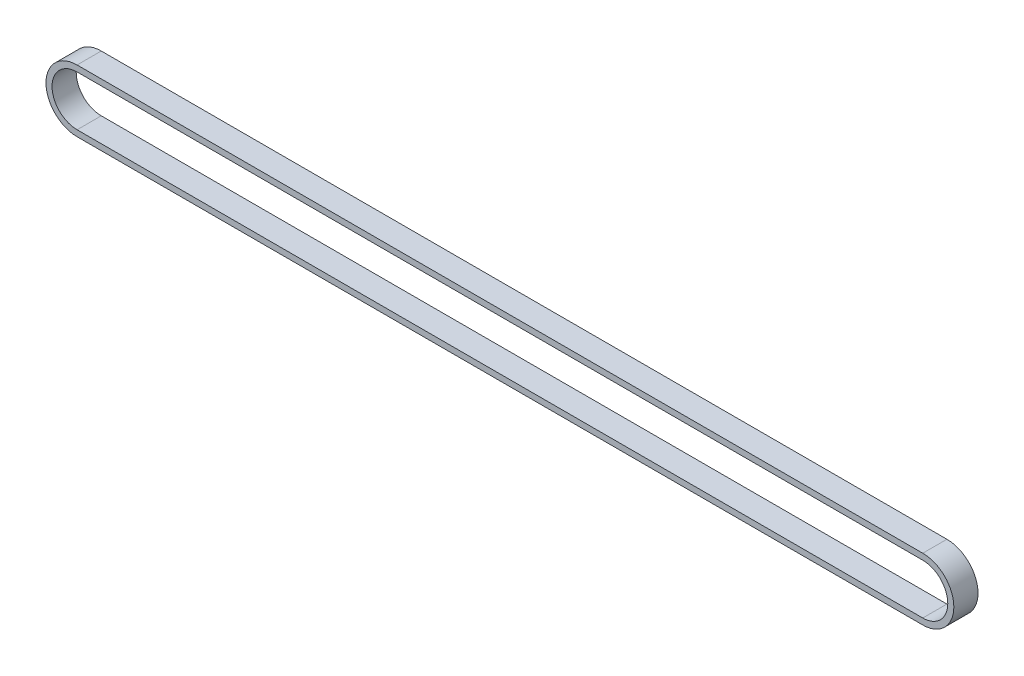
from build123d import *

# Parameters (mm, degrees)
BOSS_EXTRUDE1_DEPTH = 6


with BuildPart() as part:
    # Sketch1 → Boss-Extrude1 (new body)
    with BuildSketch(Plane.XY):
        with BuildLine():
            Line((0, 7.72), (210, 7.72))
            ThreePointArc((210, 7.72), (217.72, 0), (210, -7.72))
            Line((210, -7.72), (0, -7.72))
            ThreePointArc((0, -7.72), (-7.72, 0), (0, 7.72))
        make_face()
        with BuildLine():
            Line((0, 6.215), (210, 6.215))
            ThreePointArc((210, 6.215), (216.215, 0), (210, -6.215))
            Line((210, -6.215), (0, -6.215))
            ThreePointArc((0, -6.215), (-6.215, 0), (0, 6.215))
        make_face(mode=Mode.SUBTRACT)
    extrude(amount=BOSS_EXTRUDE1_DEPTH)


solid = part.part
